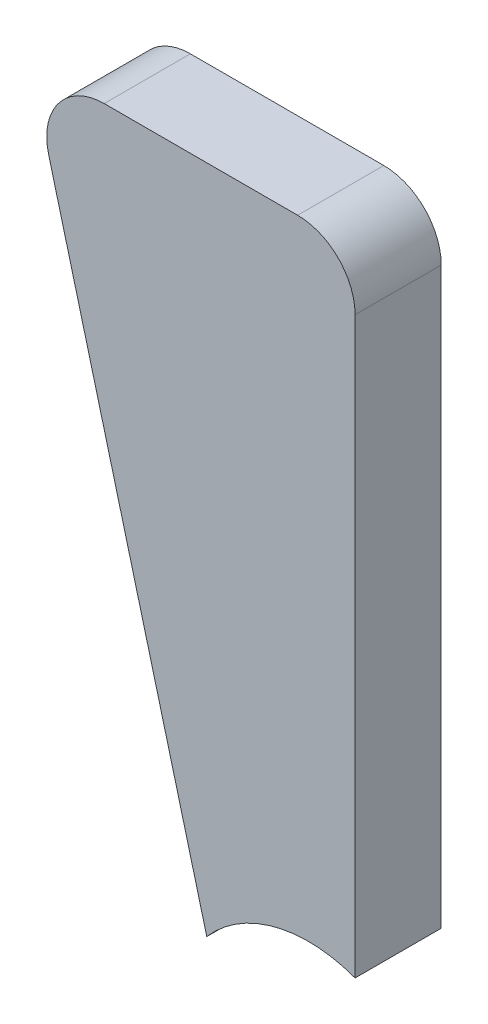
from build123d import *

# Parameters (mm, degrees)
BOSS_EXTRU_1_DEPTH = 4.5
CONG_8_R           = 3
CONG_9_R           = 3


with BuildPart() as part:
    # Esquisse1 → Boss.-Extru.1 (new body)
    with BuildSketch(Plane.XY):
        with BuildLine():
            Line((0, 0), (0, 33))
            Line((0, 33), (-17, 33))
            Line((-17, 33), (-7.745966692, -2))
            ThreePointArc((-7.745966692, -2), (-4.186842685, 0.215571991), (0, 0))
        make_face()
    extrude(amount=BOSS_EXTRU_1_DEPTH)

    # Congé8
    cong_8_edges = [part.edges().sort_by_distance(p)[0] for p in [
        (-17, 33, 2.25),
    ]]
    fillet(cong_8_edges, radius=CONG_8_R)

    # Congé9
    cong_9_edges = [part.edges().sort_by_distance(p)[0] for p in [
        (0, 33, 2.25),
    ]]
    fillet(cong_9_edges, radius=CONG_9_R)


solid = part.part
